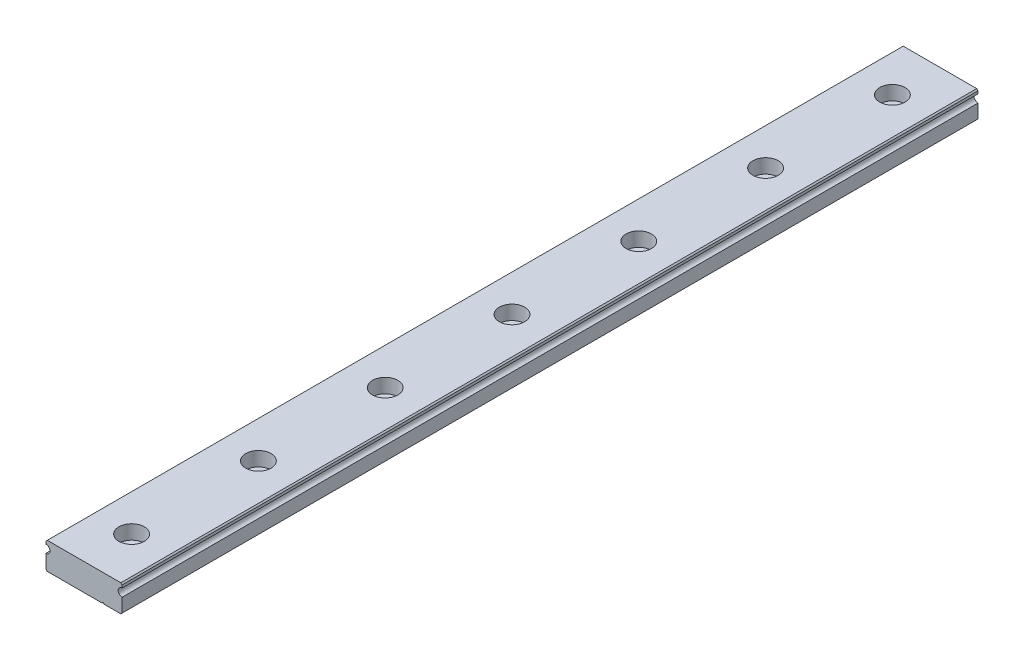
from build123d import *

# Parameters (mm, degrees)
EXTRUDE_1_DEPTH           = 270
HOLE_WIZARD_1_D           = 4.5
HOLE_WIZARD_1_CBORE_D     = 8
HOLE_WIZARD_1_CBORE_DEPTH = 4.5
PATTERN_LINEAR_1_COUNT    = 7
PATTERN_LINEAR_1_PITCH    = 40


with BuildPart() as part:
    # 草图1 → 凸台-拉伸1 (new body)
    with BuildSketch(Plane.XY):
        with BuildLine():
            Line((-12, 3), (-12, 3.85))
            Line((-12, 3.85), (-11.6, 4.25))
            Line((-11.6, 4.25), (11.6, 4.25))
            Line((11.6, 4.25), (12, 3.85))
            Line((12, 3.85), (12, 3))
            ThreePointArc((12, 3), (10.75, 1.75), (12, 0.5))
            Line((12, 0.5), (12, -3.85))
            Line((12, -3.85), (11.6, -4.25))
            Line((11.6, -4.25), (6.3, -4.25))
            ThreePointArc((6.3, -4.25), (6, -3.95), (5.7, -4.25))
            Line((5.7, -4.25), (-11.6, -4.25))
            Line((-11.6, -4.25), (-12, -3.85))
            Line((-12, -3.85), (-12, 0.5))
            ThreePointArc((-12, 0.5), (-10.75, 1.75), (-12, 3))
        make_face()
    extrude(amount=-EXTRUDE_1_DEPTH)

    # 打孔尺寸根据内六角圆柱头螺钉的类型1 (through all)
    with Locations(Plane(origin=(0, 4.25, 0), x_dir=(1, 0, 0), z_dir=(0, 1, 0))):
        with Locations((0, 15)):
            hole_wizard_1 = CounterBoreHole(HOLE_WIZARD_1_D / 2, HOLE_WIZARD_1_CBORE_D / 2, HOLE_WIZARD_1_CBORE_DEPTH)

    # 阵列(线性)1: 打孔尺寸根据内六角圆柱头螺钉的类型1 ×7
    with Locations(*[(0, 0, -i * PATTERN_LINEAR_1_PITCH) for i in range(1, PATTERN_LINEAR_1_COUNT)]):
        add(hole_wizard_1, mode=Mode.SUBTRACT)


solid = part.part
